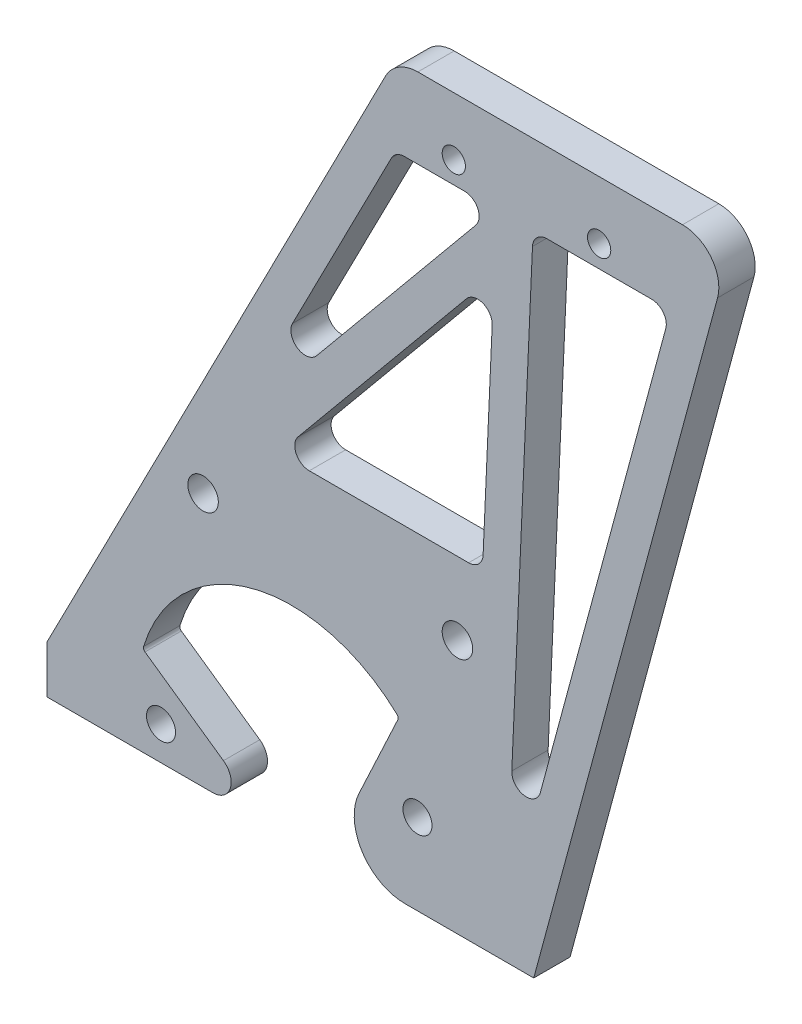
from build123d import *

# Parameters (mm, degrees)
SKETCH_1_W          = 67
SKETCH_1_H          = 30
EXTRUDE_1_DEPTH     = 5
SKETCH_3_R          = 11.5
CUT_EXTRUDE_1_DEPTH = 38.043892884
CUT_EXTRUDE_2_DEPTH = 5
EXTRUDE_2_DEPTH     = 5
FILLET_1_R          = 2.5
FILLET_3_R          = 0.5
FILLET_4_R          = 7
SKETCH_6_R          = 2
CUT_EXTRUDE_3_DEPTH = 43.09809972
EXTRUDE_3_DEPTH     = 5
CUT_EXTRUDE_4_DEPTH = 97.489636749
EXTRUDE_4_DEPTH     = 5
SKETCH_10_R         = 2.1
CUT_EXTRUDE_5_DEPTH = 97.489636749
FILLET_5_R          = 5
SKETCH_11_R         = 1.6
CUT_EXTRUDE_6_DEPTH = 96.538335837
CUT_EXTRUDE_7_DEPTH = 10
FILLET_6_R          = 2


with BuildPart() as part:
    # 草图1 → 凸台-拉伸1 (new body)
    with BuildSketch(Plane.XY):
        Rectangle(SKETCH_1_W, SKETCH_1_H)
    extrude(amount=EXTRUDE_1_DEPTH)

    # 草图3 → 切除-拉伸1 (cut, through all)
    with BuildSketch(Plane.XY.offset(5)):
        with Locations((0.155997342, -18.5)):
            Circle(SKETCH_3_R)
    extrude(amount=-CUT_EXTRUDE_1_DEPTH, mode=Mode.SUBTRACT)

    # 草图4 → 切除-拉伸2 (cut)
    with BuildSketch(Plane.XY.offset(5)):
        with BuildLine():
            Line((14.951296016, -3.246749948), (0.155997342, -34.975370344))
            Line((0.155997342, -34.975370344), (0.155997342, -27))
            Line((0.155997342, -27), (-20.283732192, -12.687947301))
            ThreePointArc((-20.283732192, -12.687947301), (-5.343907366, 2.025923809), (14.951296016, -3.246749948))
        make_face()
    extrude(amount=-CUT_EXTRUDE_2_DEPTH, mode=Mode.SUBTRACT)

    # 草图5 → 凸台-拉伸2 (add)
    with BuildSketch(Plane.XY.offset(5)):
        Polygon((-16.981778738, -15), (-2.700298671, -25), (-33.5, -25), (-33.5, -15), align=None)
        Polygon((33.5, -15), (33.5, -25), (4.807588927, -25), (10.334473164, -13.147558505), align=None)
    extrude(amount=-EXTRUDE_2_DEPTH)

    # 圆角1
    fillet_1_edges = [part.edges().sort_by_distance(p)[0] for p in [
        (-2.700298671, -25, 2.5),
    ]]
    fillet(fillet_1_edges, radius=FILLET_1_R)

    # 圆角3
    fillet_3_edges = [part.edges().sort_by_distance(p)[0] for p in [
        (14.951296016, -3.246749948, 2.5),
        (-20.283732192, -12.687947301, 2.5),
    ]]
    fillet(fillet_3_edges, radius=FILLET_3_R)

    # 圆角4
    fillet_4_edges = [part.edges().sort_by_distance(p)[0] for p in [
        (4.807588927, -25, 2.5),
    ]]
    fillet(fillet_4_edges, radius=FILLET_4_R)

    # 草图6 → 切除-拉伸3 (cut, through all)
    with BuildSketch(Plane.XY.offset(5)):
        with Locations((17.505658254, -13.841257188)):
            Circle(SKETCH_6_R)
        with Locations((-17.782400736, -20.381512339)):
            Circle(SKETCH_6_R)
    extrude(amount=-CUT_EXTRUDE_3_DEPTH, mode=Mode.SUBTRACT)

    # 草图7 → 凸台-拉伸3 (add)
    with BuildSketch(Plane.XY.offset(5)):
        Polygon((60.5, 75), (14.5, 75), (-16.303792618, 15), (33.5, 15), align=None)
    extrude(amount=-EXTRUDE_3_DEPTH)

    # 草图8 → 切除-拉伸4 (cut, through all)
    with BuildSketch(Plane.XY.offset(5)):
        Polygon((-16.303792618, 15), (-33.5, -18.49498082), (-33.5, 15), align=None)
    extrude(amount=-CUT_EXTRUDE_4_DEPTH, mode=Mode.SUBTRACT)

    # 草图9 → 凸台-拉伸4 (add)
    with BuildSketch(Plane.XY.offset(5)):
        Polygon((60.5, 75), (33.5, -25), (33.5, 15), align=None)
    extrude(amount=-EXTRUDE_4_DEPTH)

    # 草图10 → 切除-拉伸5 (cut, through all)
    with BuildSketch(Plane.XY.offset(5)):
        with Locations((-12, 10)):
            Circle(SKETCH_10_R)
        with Locations((23, 10)):
            Circle(SKETCH_10_R)
    extrude(amount=-CUT_EXTRUDE_5_DEPTH, mode=Mode.SUBTRACT)

    # 圆角5
    fillet_5_edges = [part.edges().sort_by_distance(p)[0] for p in [
        (60.5, 75, 2.5),
        (14.5, 75, 2.5),
    ]]
    fillet(fillet_5_edges, radius=FILLET_5_R)

    # 草图11 → 切除-拉伸6 (cut, through all)
    with BuildSketch(Plane.XY.offset(5)):
        with Locations((42.500000039, 67)):
            Circle(SKETCH_11_R)
        with Locations((22.500000039, 67)):
            Circle(SKETCH_11_R)
    extrude(amount=-CUT_EXTRUDE_6_DEPTH, mode=Mode.SUBTRACT)

    # 草图12 → 切除-拉伸7 (cut)
    with BuildSketch(Plane.XY.offset(5)):
        Polygon((33.412019277, 64), (31.452414539, 20), (29.670955687, -20), (52.350955687, 64), align=None)
        Polygon((28.047412755, 55.924590701), (-1.630833947, 20), (26.447458252, 20), align=None)
        Polygon((14.473082867, 64), (-8.116365053, 20), (28.233189094, 64), align=None)
    extrude(amount=-CUT_EXTRUDE_7_DEPTH, mode=Mode.SUBTRACT)

    # 圆角6
    fillet_6_edges = [part.edges().sort_by_distance(p)[0] for p in [
        (29.670955687, -20, 2.5),
        (33.412019277, 64, 2.5),
        (52.350955687, 64, 2.5),
        (14.473082867, 64, 2.5),
        (28.233189094, 64, 2.5),
        (-8.116365053, 20, 2.5),
        (28.047412755, 55.924590701, 2.5),
        (26.447458252, 20, 2.5),
        (-1.630833947, 20, 2.5),
    ]]
    fillet(fillet_6_edges, radius=FILLET_6_R)


solid = part.part
